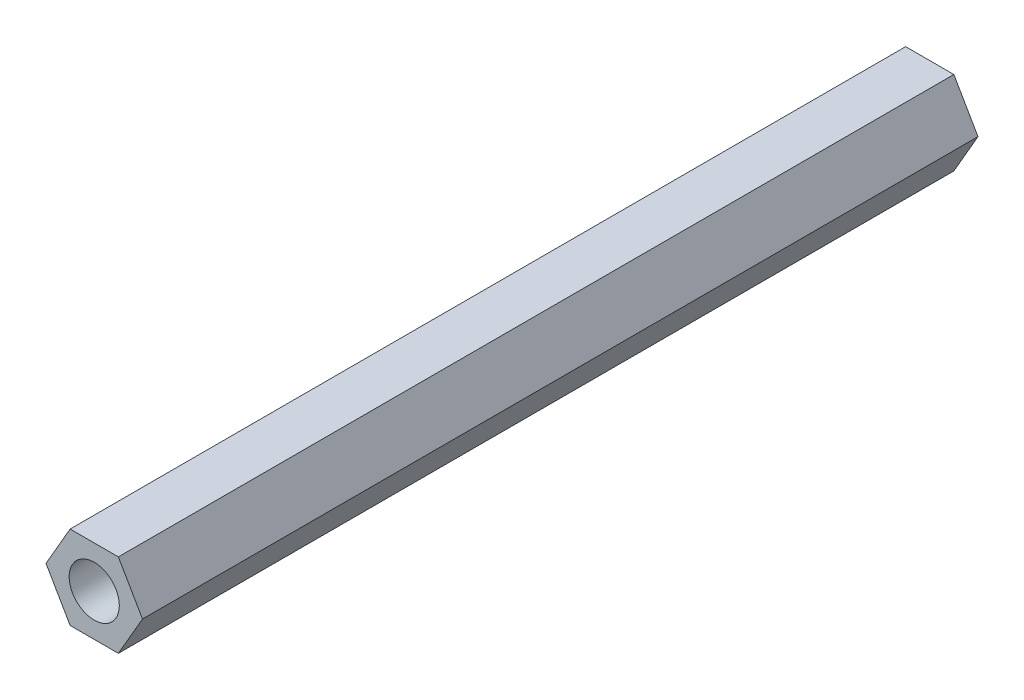
from build123d import *

# Parameters (mm, degrees)
CROQUIS1_R              = 1.5
SALIENTE_EXTRUIR1_DEPTH = 50


with BuildPart() as part:
    # Croquis1 → Saliente-Extruir1 (new body)
    with BuildSketch(Plane.XY):
        Polygon((2.886751346, 0), (1.443375673, 2.5), (-1.443375673, 2.5), (-2.886751346, 0), (-1.443375673, -2.5), (1.443375673, -2.5), align=None)
        Circle(CROQUIS1_R, mode=Mode.SUBTRACT)
    extrude(amount=-SALIENTE_EXTRUIR1_DEPTH)


solid = part.part
